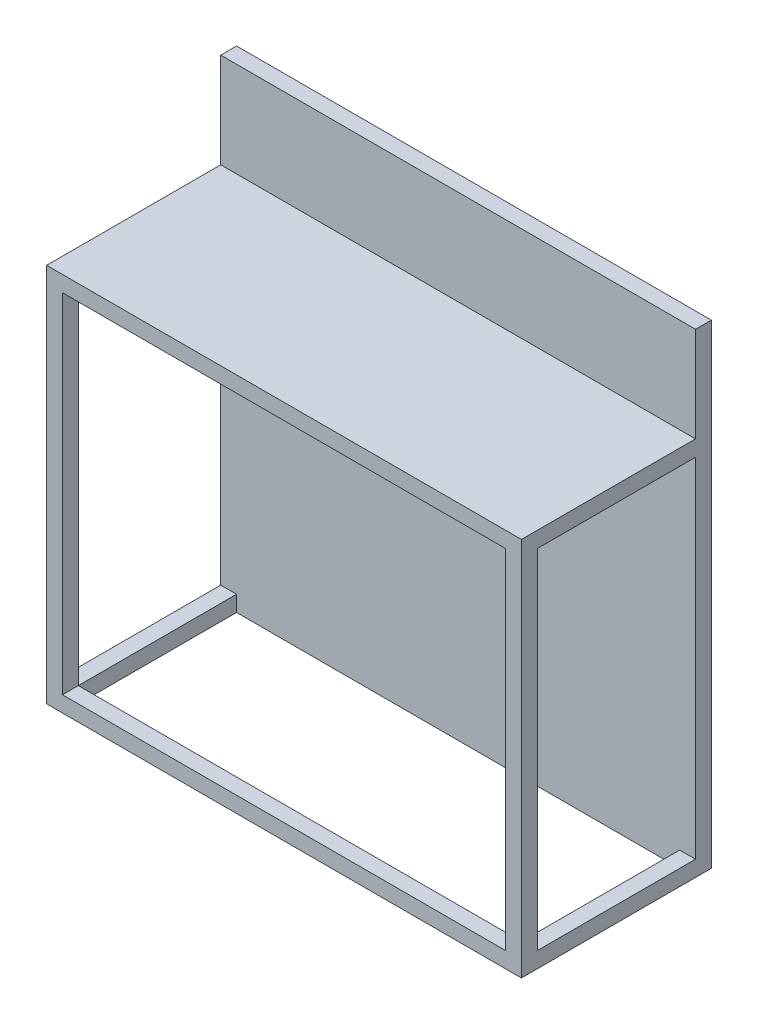
from build123d import *

# Parameters (mm, degrees)
SKETCH1_W           = 1500
SKETCH1_H           = 1500
BOSS_EXTRUDE1_DEPTH = 600
CUT_EXTRUDE1_REACH  = 1783.151
SKETCH4_W           = 550
SKETCH4_H           = 300
SKETCH5_W           = 1400
SKETCH5_H           = 500
CUT_EXTRUDE2_DEPTH  = 1150
SKETCH6_W           = 500
SKETCH6_H           = 1100
CUT_EXTRUDE3_DEPTH  = 2364
SKETCH7_W           = 1400
SKETCH7_H           = 1100
CUT_EXTRUDE4_DEPTH  = 320


with BuildPart() as part:
    # Sketch1 → Boss-Extrude1 (new body)
    with BuildSketch(Plane.XY):
        Rectangle(SKETCH1_W, SKETCH1_H)
    extrude(amount=BOSS_EXTRUDE1_DEPTH)

    # Sketch4 → Cut-Extrude1 (cut, up to next)
    with BuildSketch(Plane.ZY.offset(750), mode=Mode.PRIVATE) as cut_extrude1_sk1:
        with Locations((325, 600)):
            Rectangle(SKETCH4_W, SKETCH4_H)
    cut_extrude1_tool1 = extrude(cut_extrude1_sk1.sketch, amount=-CUT_EXTRUDE1_REACH, mode=Mode.PRIVATE) & part.part
    add(cut_extrude1_tool1.solids().sort_by_distance((-750, 600, 325))[0], mode=Mode.SUBTRACT)

    # Sketch5 → Cut-Extrude2 (cut)
    with BuildSketch(Plane.XZ.offset(750)):
        with Locations((0, 300)):
            Rectangle(SKETCH5_W, SKETCH5_H)
    extrude(amount=-CUT_EXTRUDE2_DEPTH, mode=Mode.SUBTRACT)

    # Sketch6 → Cut-Extrude3 (cut)
    with BuildSketch(Plane.ZY.offset(750)):
        with Locations((300, -150)):
            Rectangle(SKETCH6_W, SKETCH6_H)
    extrude(amount=-CUT_EXTRUDE3_DEPTH, mode=Mode.SUBTRACT)

    # Sketch7 → Cut-Extrude4 (cut)
    with BuildSketch(Plane.XY.offset(600)):
        with Locations((0, -150)):
            Rectangle(SKETCH7_W, SKETCH7_H)
    extrude(amount=-CUT_EXTRUDE4_DEPTH, mode=Mode.SUBTRACT)


solid = part.part
